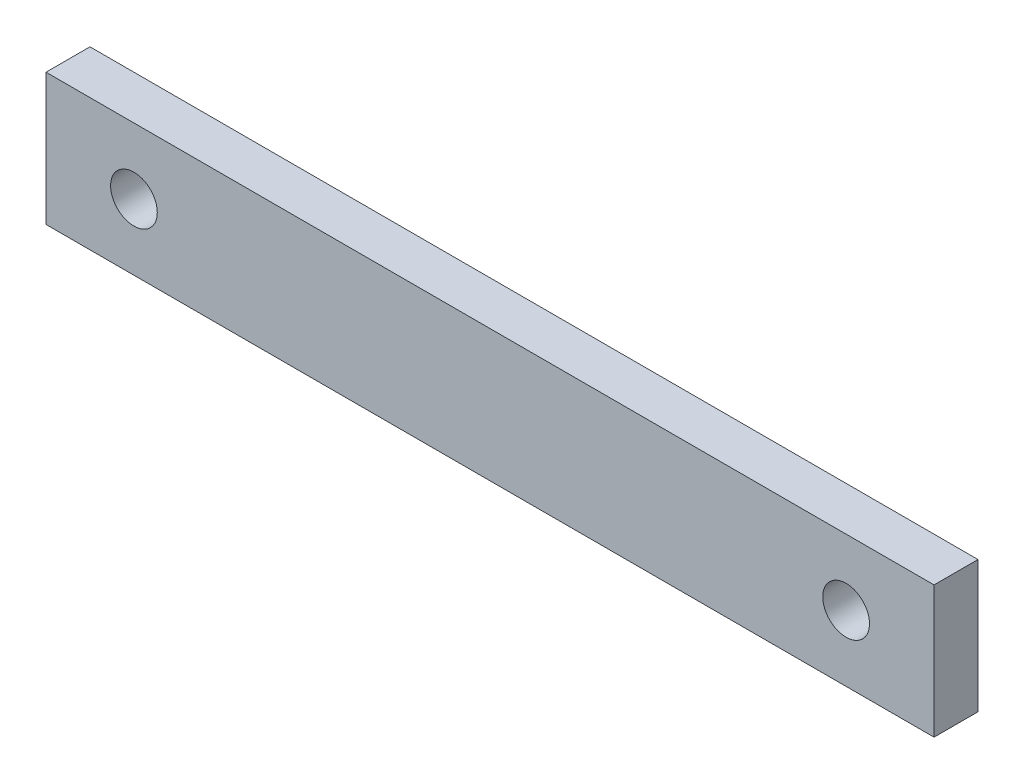
from build123d import *

# Parameters (mm, degrees)
SKETCH1_W           = 128.27
SKETCH1_H           = 19.05
BOSS_EXTRUDE1_DEPTH = 6.35
SKETCH2_R           = 3.3734375
CUT_EXTRUDE1_DEPTH  = 6.35


with BuildPart() as part:
    # Sketch1 → Boss-Extrude1 (new body)
    with BuildSketch(Plane.XY):
        Rectangle(SKETCH1_W, SKETCH1_H)
    extrude(amount=BOSS_EXTRUDE1_DEPTH)

    # Sketch2 → Cut-Extrude1 (cut)
    with BuildSketch(Plane.XY.offset(6.35)):
        with Locations((-51.435, 0)):
            Circle(SKETCH2_R)
        with Locations((51.435, 0)):
            Circle(SKETCH2_R)
    extrude(amount=-CUT_EXTRUDE1_DEPTH, mode=Mode.SUBTRACT)


solid = part.part
